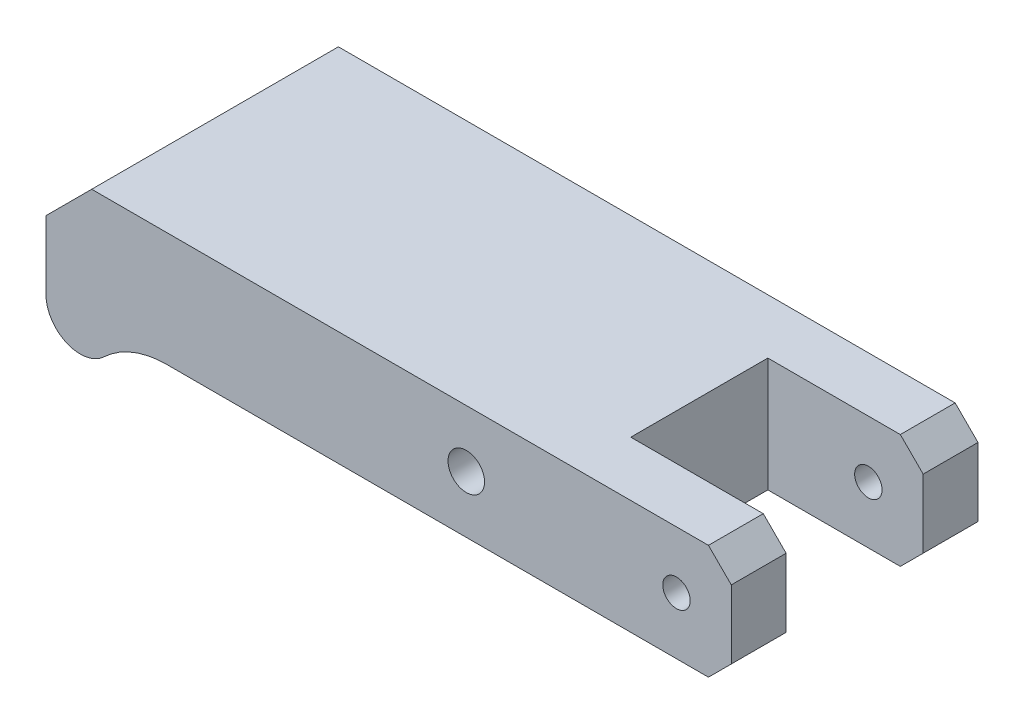
from build123d import *

# Parameters (mm, degrees)
SCHIZZO1_R                   = 3
SCHIZZO1_R_2                 = 4
ESTRUSIONE_ESTRUSIONE1_DEPTH = 54
SCHIZZO2_W                   = 30
SCHIZZO2_H                   = 25
TAGLIO_ESTRUSIONE1_DEPTH     = 34
SMUSSO1_SIZE                 = 5
SMUSSO2_SIZE                 = 10


with BuildPart() as part:
    # Schizzo1 → Estrusione-Estrusione1 (new body)
    with BuildSketch(Plane.XY):
        with BuildLine():
            Line((-48.625413912, -12.5), (75, -12.5))
            Line((75, -12.5), (75, 12.5))
            Line((75, 12.5), (-75, 12.5))
            Line((-75, 12.5), (-75, -12.5))
            ThreePointArc((-75, -12.5), (-70.470091926, -19.386839185), (-62.352385612, -17.954545455))
            ThreePointArc((-62.352385612, -17.954545455), (-56.010903371, -13.913592454), (-48.625413912, -12.5))
        make_face()
        with Locations((63, 0)):
            Circle(SCHIZZO1_R, mode=Mode.SUBTRACT)
        with Locations((17, 0)):
            Circle(SCHIZZO1_R_2, mode=Mode.SUBTRACT)
    extrude(amount=ESTRUSIONE_ESTRUSIONE1_DEPTH)

    # Schizzo2 → Taglio-Estrusione1 (cut)
    with BuildSketch(Plane(origin=(75, 0, 0), x_dir=(0, 0, -1), z_dir=(1, 0, 0))):
        with Locations((-27, 0)):
            Rectangle(SCHIZZO2_W, SCHIZZO2_H)
    extrude(amount=-TAGLIO_ESTRUSIONE1_DEPTH, mode=Mode.SUBTRACT)

    # Smusso1
    smusso1_edges = [part.edges().sort_by_distance(p)[0] for p in [
        (75, -12.5, 48),
        (75, 12.5, 48),
        (75, -12.5, 6),
        (75, 12.5, 6),
    ]]
    chamfer(smusso1_edges, length=SMUSSO1_SIZE)

    # Smusso2
    smusso2_edges = [part.edges().sort_by_distance(p)[0] for p in [
        (-75, 12.5, 27),
    ]]
    chamfer(smusso2_edges, length=SMUSSO2_SIZE)


solid = part.part
